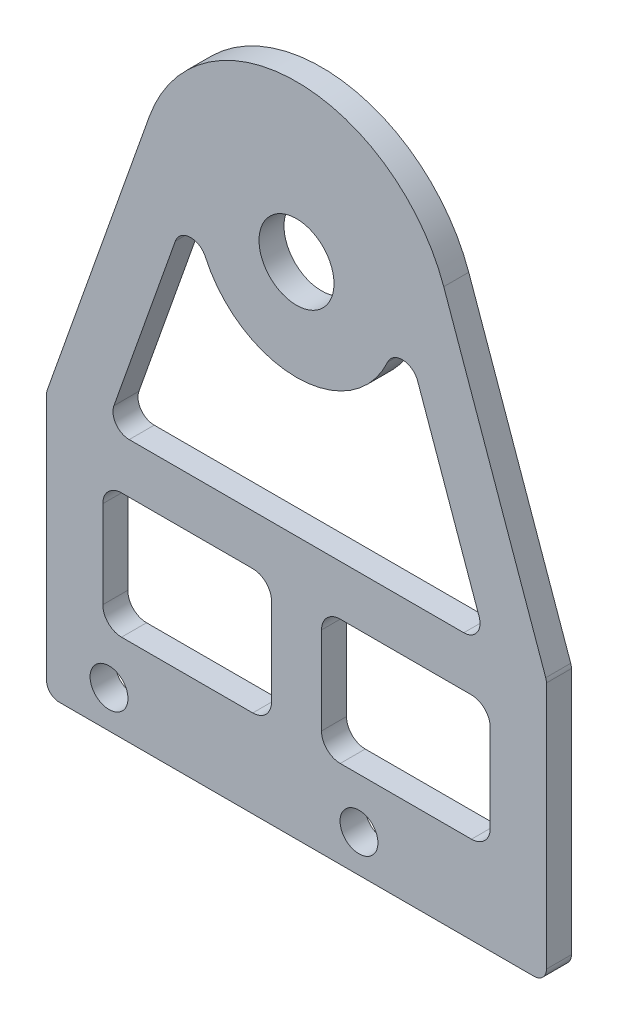
from build123d import *

# Parameters (mm, degrees)
SKETCH_1_R          = 3
EXTRUDE_1_DEPTH     = 2
FILLET_1_R          = 1
SKETCH_2_R          = 1.515
CUT_EXTRUDE_1_DEPTH = 10
CUT_EXTRUDE_2_DEPTH = 10
FILLET_2_R          = 1.3
SKETCH_4_W          = 31
SKETCH_4_H          = 10
CUT_EXTRUDE_3_DEPTH = 10
SKETCH_5_W          = 4
SKETCH_5_H          = 10
EXTRUDE_1_2_DEPTH   = 2
FILLET_4_R          = 1.5


with BuildPart() as part:
    # 草图1 → Extrude 1 (new body)
    with BuildSketch(Plane.XY):
        with BuildLine():
            Line((-20, -40), (20, -40))
            Line((20, -40), (20, -19))
            Line((20, -19), (11.781235871, 4.177616707))
            ThreePointArc((11.781235871, 4.177616707), (0, 12.5), (-11.781235871, 4.177616707))
            Line((-11.781235871, 4.177616707), (-20, -19))
            Line((-20, -19), (-20, -40))
        make_face()
        Circle(SKETCH_1_R, mode=Mode.SUBTRACT)
    extrude(amount=EXTRUDE_1_DEPTH)

    # 圆角1
    fillet_1_edges = [part.edges().sort_by_distance(p)[0] for p in [
        (20, -19, 1),
        (20, -40, 1),
        (-20, -40, 1),
        (-20, -19, 1),
    ]]
    fillet(fillet_1_edges, radius=FILLET_1_R)

    # 草图2 → 切除-拉伸1 (cut)
    with BuildSketch(Plane(origin=(0, 0, 0), x_dir=(-1, 0, 0), z_dir=(0, 0, -1))):
        with Locations((15, -37)):
            Circle(SKETCH_2_R)
        with Locations((-5, -37)):
            Circle(SKETCH_2_R)
    extrude(amount=-CUT_EXTRUDE_1_DEPTH, mode=Mode.SUBTRACT)

    # 草图3 → 切除-拉伸2 (cut)
    with BuildSketch(Plane(origin=(0, 0, 0), x_dir=(-1, 0, 0), z_dir=(0, 0, -1))):
        with BuildLine():
            Line((-7.539990958, 2.673674692), (-15.225458465, -19))
            Line((-15.225458465, -19), (15.225458465, -19))
            Line((15.225458465, -19), (7.539990958, 2.673674692))
            ThreePointArc((7.539990958, 2.673674692), (0, -8), (-7.539990958, 2.673674692))
        make_face()
    extrude(amount=-CUT_EXTRUDE_2_DEPTH, mode=Mode.SUBTRACT)

    # 圆角2
    fillet_2_edges = [part.edges().sort_by_distance(p)[0] for p in [
        (7.539990958, 2.673674692, 1),
        (-7.539990958, 2.673674692, 1),
        (-15.225458465, -19, 1),
        (15.225458465, -19, 1),
    ]]
    fillet(fillet_2_edges, radius=FILLET_2_R)

    # 草图4 → 切除-拉伸3 (cut)
    with BuildSketch(Plane(origin=(0, 0, 0), x_dir=(-1, 0, 0), z_dir=(0, 0, -1))):
        with Locations((0, -28)):
            Rectangle(SKETCH_4_W, SKETCH_4_H)
    extrude(amount=-CUT_EXTRUDE_3_DEPTH, mode=Mode.SUBTRACT)

    # 草图5 → Extrude 1 2 (add)
    with BuildSketch(Plane(origin=(0, 0, 0), x_dir=(-1, 0, 0), z_dir=(0, 0, -1))):
        with Locations((0, -28)):
            Rectangle(SKETCH_5_W, SKETCH_5_H)
    extrude(amount=-EXTRUDE_1_2_DEPTH)

    # 圆角4
    fillet_4_edges = [part.edges().sort_by_distance(p)[0] for p in [
        (15.5, -33, 1),
        (15.5, -23, 1),
        (-15.5, -23, 1),
        (-15.5, -33, 1),
        (2, -33, 1),
        (2, -23, 1),
        (-2, -23, 1),
        (-2, -33, 1),
    ]]
    fillet(fillet_4_edges, radius=FILLET_4_R)


solid = part.part
